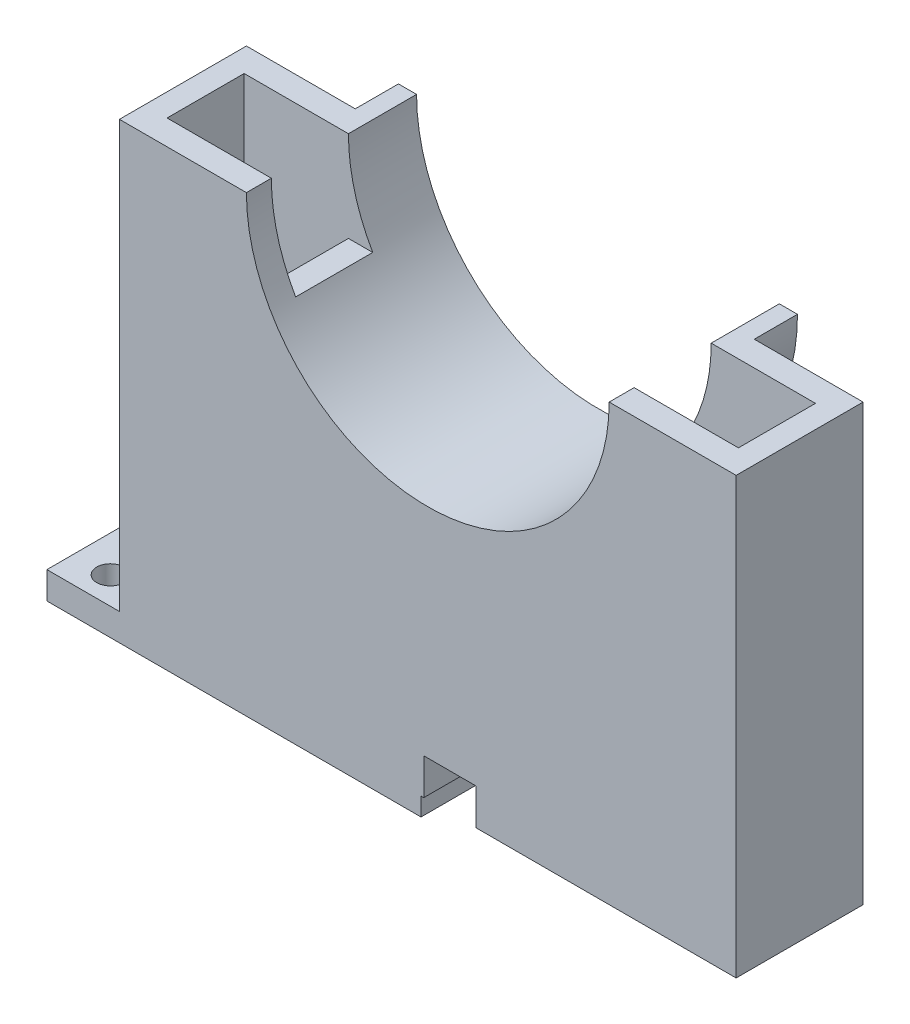
from build123d import *

# Parameters (mm, degrees)
BOSS_EXTRUDE1_DEPTH = 14
CUT_EXTRUDE1_REACH  = 94.043
SKETCH2_W           = 11.5
SKETCH2_H           = 8.5
SKETCH3_R           = 1.5
SCREW_HOLES_DEPTH   = 3
SKETCH4_W           = 63
SKETCH4_H           = 8.5
CUT_EXTRUDE2_DEPTH  = 10
CUT_EXTRUDE3_REACH  = 94.043
SKETCH5_W           = 34.745
SKETCH5_H           = 2
SKETCH6_W           = 5.75
SKETCH6_H           = 4
CUT_EXTRUDE4_DEPTH  = 14
BOSS_EXTRUDE2_START = -18.7625
BOSS_EXTRUDE2_DEPTH = 4.7625


with BuildPart() as part:
    # Sketch1 → Boss-Extrude1 (new body)
    with BuildSketch(Plane.XY):
        with BuildLine():
            Line((0, 0), (0, 3))
            Line((0, 3), (8, 3))
            Line((8, 3), (8, 50))
            Line((8, 50), (22, 50))
            ThreePointArc((22, 50), (42, 30), (62, 50))
            Line((62, 50), (76, 50))
            Line((76, 50), (76, 0))
            Line((76, 0), (0, 0))
        make_face()
    extrude(amount=BOSS_EXTRUDE1_DEPTH)

    # Cut-Extrude1: up to this face of the body (flat: up to its plane)
    cut_extrude1_end = Plane(part.part.faces().sort_by_distance((15, 50, 7))[0])
    # Sketch2 → Cut-Extrude1 (cut, up to the picked face)
    with BuildSketch(Plane.XZ, mode=Mode.PRIVATE) as cut_extrude1_sk1:
        with Locations((67.75, 7)):
            Rectangle(SKETCH2_W, SKETCH2_H)
    cut_extrude1_tool1 = split(extrude(cut_extrude1_sk1.sketch, amount=-CUT_EXTRUDE1_REACH, mode=Mode.PRIVATE), bisect_by=cut_extrude1_end, keep=Keep.BOTH, mode=Mode.PRIVATE)
    # Sketch2 → Cut-Extrude1 (cut, up to the picked face)
    with BuildSketch(Plane.XZ, mode=Mode.PRIVATE) as cut_extrude1_sk2:
        with Locations((16.25, 7)):
            Rectangle(SKETCH2_W, SKETCH2_H)
    cut_extrude1_tool2 = split(extrude(cut_extrude1_sk2.sketch, amount=-CUT_EXTRUDE1_REACH, mode=Mode.PRIVATE), bisect_by=cut_extrude1_end, keep=Keep.BOTH, mode=Mode.PRIVATE)
    add(cut_extrude1_tool1.solids().sort_by(Axis((67.75, 0, 7), (0, 1, 0)))[0], mode=Mode.SUBTRACT)
    add(cut_extrude1_tool2.solids().sort_by(Axis((16.25, 0, 7), (0, 1, 0)))[0], mode=Mode.SUBTRACT)

    # Sketch3 → screw holes (cut)
    with BuildSketch(Plane(origin=(0, 3, 0), x_dir=(1, 0, 0), z_dir=(0, 1, 0))):
        with Locations(Location((4, -3, 0), (0, 0, 270))):
            Circle(SKETCH3_R)
        with Locations(Location((4, -11, 0), (0, 0, 270))):
            Circle(SKETCH3_R)
    extrude(amount=-SCREW_HOLES_DEPTH, mode=Mode.SUBTRACT)

    # Sketch4 → Cut-Extrude2 (cut)
    with BuildSketch(Plane(origin=(0, 50, 0), x_dir=(1, 0, 0), z_dir=(0, 1, 0))):
        with Locations((42, -7)):
            Rectangle(SKETCH4_W, SKETCH4_H)
    extrude(amount=-CUT_EXTRUDE2_DEPTH, mode=Mode.SUBTRACT)

    # Cut-Extrude3: up to this face of the body (flat: up to its plane)
    cut_extrude3_end = Plane(part.part.faces().sort_by_distance((41.673782579, 21.087311786, 14))[0])
    # Sketch5 → Cut-Extrude3 (cut, up to the picked face)
    with BuildSketch(Plane(origin=(0, 0, 0), x_dir=(-1, 0, 0), z_dir=(0, 0, -1)), mode=Mode.PRIVATE) as cut_extrude3_sk1:
        with Locations((-58.6275, 1)):
            Rectangle(SKETCH5_W, SKETCH5_H)
    cut_extrude3_tool1 = split(extrude(cut_extrude3_sk1.sketch, amount=-CUT_EXTRUDE3_REACH, mode=Mode.PRIVATE), bisect_by=cut_extrude3_end, keep=Keep.BOTH, mode=Mode.PRIVATE)
    add(cut_extrude3_tool1.solids().sort_by(Axis((58.6275, 1, 0), (0, 0, 1)))[0], mode=Mode.SUBTRACT)

    # Sketch6 → Cut-Extrude4 (cut)
    with BuildSketch(Plane.XY.offset(14)):
        with Locations((44.43, 4)):
            Rectangle(SKETCH6_W, SKETCH6_H)
    extrude(amount=-CUT_EXTRUDE4_DEPTH, mode=Mode.SUBTRACT)

    # Sketch7 → Boss-Extrude2 (add)
    with BuildSketch(Plane.XY.offset(14).offset(BOSS_EXTRUDE2_START)):
        with BuildLine():
            Line((22, 50), (20, 50))
            ThreePointArc((20, 50), (42, 28), (64, 50))
            Line((64, 50), (62, 50))
            ThreePointArc((62, 50), (42, 30), (22, 50))
        make_face()
    extrude(amount=BOSS_EXTRUDE2_DEPTH)


solid = part.part
